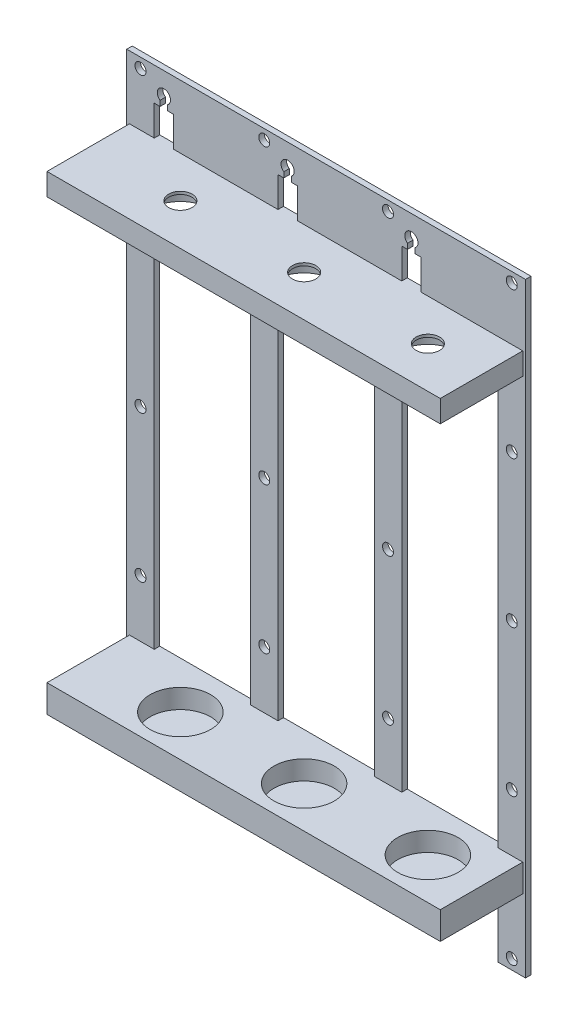
from build123d import *

# Parameters (mm, degrees)
SZKIC4_R                    = 2
DODANIE_WYCI_GNI_CIE1_DEPTH = 2
DODANIE_WYCI_GNI_CIE2_DEPTH = 30
SZKIC6_W                    = 35
SZKIC6_H                    = 10
DODANIE_WYCI_GNI_CIE3_DEPTH = 2
SZKIC7_R                    = 11
WYTNIJ_WYCI_GNI_CIE1_DEPTH  = 7
SZKIC7_4_R                  = 11
WYTNIJ_WYCI_GNI_CIE2_DEPTH  = 7
SZKIC7_5_R                  = 11
WYTNIJ_WYCI_GNI_CIE3_DEPTH  = 7
SZKIC12_W                   = 145
SZKIC12_H                   = 8
DODANIE_WYCI_GNI_CIE5_DEPTH = 30
SZKIC13_R                   = 4.25
WYTNIJ_WYCI_GNI_CIE9_DEPTH  = 59
WYTNIJ_WYCI_GNI_CIE10_START = -7
SZKIC13_3_R                 = 11
WYTNIJ_WYCI_GNI_CIE10_DEPTH = 7
WYTNIJ_WYCI_GNI_CIE11_DEPTH = 178


with BuildPart() as part:
    # Szkic4 → Dodanie-wyciągnięcie1 (new body)
    with BuildSketch(Plane.XY):
        Polygon((71.861585453, -220), (81.861585453, -220), (81.861585453, 0), (-63.138414547, 0), (-63.138414547, -220), (-53.138414547, -220), (-53.138414547, -31), (-18.138414547, -31), (-18.138414547, -220), (-8.138414547, -220), (-8.138414547, -31), (26.861585453, -31), (26.861585453, -220), (36.861585453, -220), (36.861585453, -31), (71.861585453, -31), align=None)
        with Locations((76.861585453, -3.6)):
            Circle(SZKIC4_R, mode=Mode.SUBTRACT)
        with Locations((31.861585453, -3.6)):
            Circle(SZKIC4_R, mode=Mode.SUBTRACT)
        with Locations((-13.138414547, -3.6)):
            Circle(SZKIC4_R, mode=Mode.SUBTRACT)
        with Locations((-58.138414547, -3.6)):
            Circle(SZKIC4_R, mode=Mode.SUBTRACT)
        with Locations((76.861585453, -56.8)):
            Circle(SZKIC4_R, mode=Mode.SUBTRACT)
        with Locations((31.861585453, -56.8)):
            Circle(SZKIC4_R, mode=Mode.SUBTRACT)
        with Locations((-13.138414547, -56.8)):
            Circle(SZKIC4_R, mode=Mode.SUBTRACT)
        with Locations((76.861585453, -110)):
            Circle(SZKIC4_R, mode=Mode.SUBTRACT)
        with Locations((31.861585453, -110)):
            Circle(SZKIC4_R, mode=Mode.SUBTRACT)
        with Locations((-13.138414547, -110)):
            Circle(SZKIC4_R, mode=Mode.SUBTRACT)
        with Locations((76.861585453, -163.2)):
            Circle(SZKIC4_R, mode=Mode.SUBTRACT)
        with Locations((31.861585453, -163.2)):
            Circle(SZKIC4_R, mode=Mode.SUBTRACT)
        with Locations((-13.138414547, -163.2)):
            Circle(SZKIC4_R, mode=Mode.SUBTRACT)
        with Locations((76.861585453, -216.4)):
            Circle(SZKIC4_R, mode=Mode.SUBTRACT)
        with Locations((31.861585453, -216.4)):
            Circle(SZKIC4_R, mode=Mode.SUBTRACT)
        with Locations((-13.138414547, -216.4)):
            Circle(SZKIC4_R, mode=Mode.SUBTRACT)
        with Locations((-58.138414547, -56.8)):
            Circle(SZKIC4_R, mode=Mode.SUBTRACT)
        with Locations((-58.138414547, -110)):
            Circle(SZKIC4_R, mode=Mode.SUBTRACT)
        with Locations((-58.138414547, -163.2)):
            Circle(SZKIC4_R, mode=Mode.SUBTRACT)
        with Locations((-58.138414547, -216.4)):
            Circle(SZKIC4_R, mode=Mode.SUBTRACT)
        with BuildLine():
            Line((-48.238414547, -12), (-48.238414547, -10.049358869))
            ThreePointArc((-48.238414547, -10.049358869), (-49.638414547, -5.7), (-51.038414547, -10.049358869))
            Line((-51.038414547, -10.049358869), (-51.038414547, -12))
            Line((-51.038414547, -12), (-53.138414547, -12))
            Line((-53.138414547, -12), (-53.138414547, -23))
            Line((-53.138414547, -23), (-46.138414547, -23))
            Line((-46.138414547, -23), (-46.138414547, -12))
            Line((-46.138414547, -12), (-48.238414547, -12))
        make_face(mode=Mode.SUBTRACT)
        with BuildLine():
            Line((-3.238414547, -12), (-3.238414547, -10.049358869))
            ThreePointArc((-3.238414547, -10.049358869), (-4.638414547, -5.7), (-6.038414547, -10.049358869))
            Line((-6.038414547, -10.049358869), (-6.038414547, -12))
            Line((-6.038414547, -12), (-8.138414547, -12))
            Line((-8.138414547, -12), (-8.138414547, -23))
            Line((-8.138414547, -23), (-1.138414547, -23))
            Line((-1.138414547, -23), (-1.138414547, -12))
            Line((-1.138414547, -12), (-3.238414547, -12))
        make_face(mode=Mode.SUBTRACT)
        with BuildLine():
            Line((41.761585453, -12), (41.761585453, -10.049358869))
            ThreePointArc((41.761585453, -10.049358869), (40.361585453, -5.7), (38.961585453, -10.049358869))
            Line((38.961585453, -10.049358869), (38.961585453, -12))
            Line((38.961585453, -12), (36.861585453, -12))
            Line((36.861585453, -12), (36.861585453, -23))
            Line((36.861585453, -23), (43.861585453, -23))
            Line((43.861585453, -23), (43.861585453, -12))
            Line((43.861585453, -12), (41.761585453, -12))
        make_face(mode=Mode.SUBTRACT)
    extrude(amount=DODANIE_WYCI_GNI_CIE1_DEPTH)

    # Szkic5 → Dodanie-wyciągnięcie2 (add)
    with BuildSketch(Plane.XY.offset(2)):
        Polygon((-63.138414547, -192), (-63.138414547, -194), (81.861585453, -194), (81.861585453, -184), (-63.138414547, -184), (-63.138414547, -185), align=None)
    extrude(amount=DODANIE_WYCI_GNI_CIE2_DEPTH)

    # Szkic6 → Dodanie-wyciągnięcie3 (add)
    with BuildSketch(Plane(origin=(0, 0, 2), x_dir=(-1, 0, 0), z_dir=(0, 0, -1))):
        with Locations((35.638414547, -189)):
            Rectangle(SZKIC6_W, SZKIC6_H)
        with Locations((-9.361585453, -189)):
            Rectangle(SZKIC6_W, SZKIC6_H)
        with Locations((-54.361585453, -189)):
            Rectangle(SZKIC6_W, SZKIC6_H)
    extrude(amount=DODANIE_WYCI_GNI_CIE3_DEPTH)

    # Szkic7 → Wytnij-wyciągnięcie1 (cut)
    with BuildSketch(Plane(origin=(0, -184, 0), x_dir=(1, 0, 0), z_dir=(0, 1, 0))):
        with Locations(Location((61.361585453, -17, 0), (0, 0, 270))):
            Circle(SZKIC7_R)
    extrude(amount=-WYTNIJ_WYCI_GNI_CIE1_DEPTH, mode=Mode.SUBTRACT)

    # Szkic7<4> → Wytnij-wyciągnięcie2 (cut)
    with BuildSketch(Plane(origin=(0, -184, 0), x_dir=(1, 0, 0), z_dir=(0, 1, 0))):
        with Locations(Location((16.361585453, -17, 0), (0, 0, 270))):
            Circle(SZKIC7_4_R)
    extrude(amount=-WYTNIJ_WYCI_GNI_CIE2_DEPTH, mode=Mode.SUBTRACT)

    # Szkic7<5> → Wytnij-wyciągnięcie3 (cut)
    with BuildSketch(Plane(origin=(0, -184, 0), x_dir=(1, 0, 0), z_dir=(0, 1, 0))):
        with Locations(Location((-28.638414547, -17, 0), (0, 0, 270))):
            Circle(SZKIC7_5_R)
    extrude(amount=-WYTNIJ_WYCI_GNI_CIE3_DEPTH, mode=Mode.SUBTRACT)

    # Szkic12 → Dodanie-wyciągnięcie5 (add)
    with BuildSketch(Plane.XY.offset(2)):
        with Locations((9.361585453, -27)):
            Rectangle(SZKIC12_W, SZKIC12_H)
    extrude(amount=DODANIE_WYCI_GNI_CIE5_DEPTH)

    # Szkic13 → Wytnij-wyciągnięcie9 (cut)
    with BuildSketch(Plane.XZ.offset(31)):
        with Locations(Location((61.361585453, 17, 0), (0, 0, 270))):
            Circle(SZKIC13_R)
        with Locations(Location((16.361585453, 17, 0), (0, 0, 270))):
            Circle(SZKIC13_R)
        with Locations(Location((-28.638414547, 17, 0), (0, 0, 270))):
            Circle(SZKIC13_R)
    extrude(amount=-WYTNIJ_WYCI_GNI_CIE9_DEPTH, mode=Mode.SUBTRACT)

    # Szkic13<3> → Wytnij-wyciągnięcie10 (cut)
    with BuildSketch(Plane.XZ.offset(31).offset(WYTNIJ_WYCI_GNI_CIE10_START)):
        with Locations(Location((61.361585453, 17, 0), (0, 0, 90))):
            Circle(SZKIC13_3_R)
        with Locations(Location((16.361585453, 17, 0), (0, 0, 90))):
            Circle(SZKIC13_3_R)
        with Locations(Location((-28.638414547, 17, 0), (0, 0, 90))):
            Circle(SZKIC13_3_R)
    extrude(amount=WYTNIJ_WYCI_GNI_CIE10_DEPTH, mode=Mode.SUBTRACT)

    # Szkic14 → Wytnij-wyciągnięcie11 (cut)
    with BuildSketch(Plane.XZ.offset(194)):
        Polygon((-63.138414547, 2), (-62.138414547, 2), (-62.138414547, 31), (-62.138414547, 32), (-63.138414547, 32), align=None)
        Polygon((80.861585453, 31), (80.861585453, 2), (81.861585453, 2), (81.861585453, 32), (80.861585453, 32), align=None)
    extrude(amount=-WYTNIJ_WYCI_GNI_CIE11_DEPTH, mode=Mode.SUBTRACT)


solid = part.part
